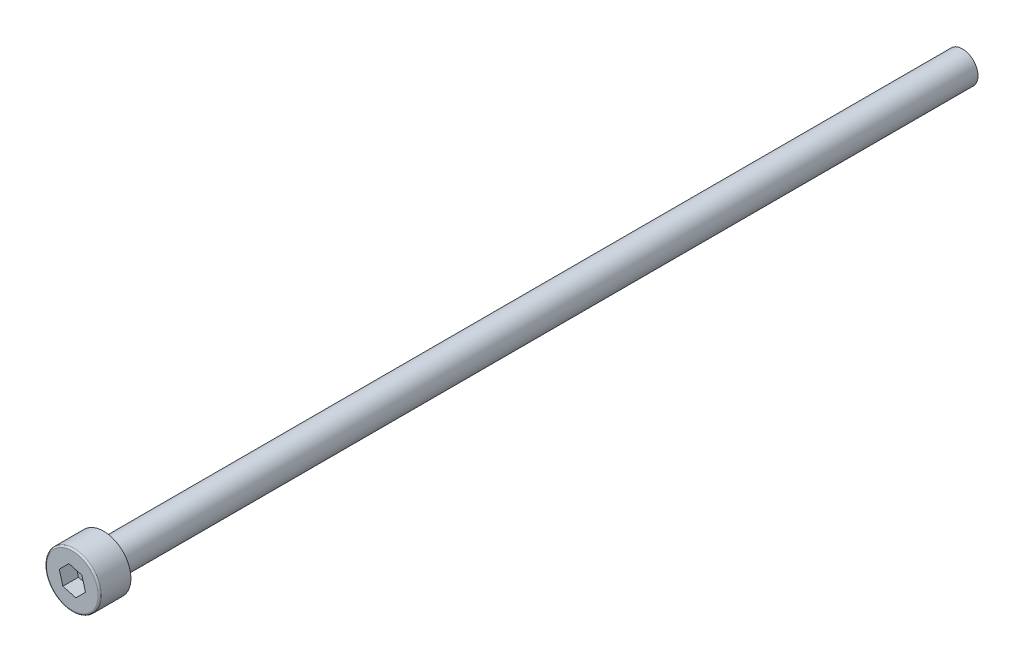
from build123d import *

# Parameters (mm, degrees)
SKETCH_1_R          = 3.5
EXTRUDE_1_DEPTH     = 4
CUT_EXTRUDE_1_DEPTH = 2
SKETCH_3_R          = 2
EXTRUDE_2_DEPTH     = 110
FILLET_1_R          = 0.2


with BuildPart() as part:
    # 草图1 → 凸台-拉伸1 (new body)
    with BuildSketch(Plane.XY):
        Circle(SKETCH_1_R)
    extrude(amount=EXTRUDE_1_DEPTH)

    # 草图2 → 切除-拉伸1 (cut)
    with BuildSketch(Plane.XY.offset(4)):
        Polygon((-1.224744871, -1.224744871), (0.448287736, -1.673032607), (1.673032607, -0.448287736), (1.224744871, 1.224744871), (-0.448287736, 1.673032607), (-1.673032607, 0.448287736), align=None)
    extrude(amount=-CUT_EXTRUDE_1_DEPTH, mode=Mode.SUBTRACT)

    # 草图3 → 凸台-拉伸2 (add)
    with BuildSketch(Plane(origin=(0, 0, 0), x_dir=(-1, 0, 0), z_dir=(0, 0, -1))):
        with Locations(Location((0, 0, 0), (0, 0, 180))):
            Circle(SKETCH_3_R)
    extrude(amount=EXTRUDE_2_DEPTH)

    # 圆角1
    fillet_1_edges = [part.edges().sort_by_distance(p)[0] for p in [
        (-3.5, 0, 4),
    ]]
    fillet(fillet_1_edges, radius=FILLET_1_R)


solid = part.part
